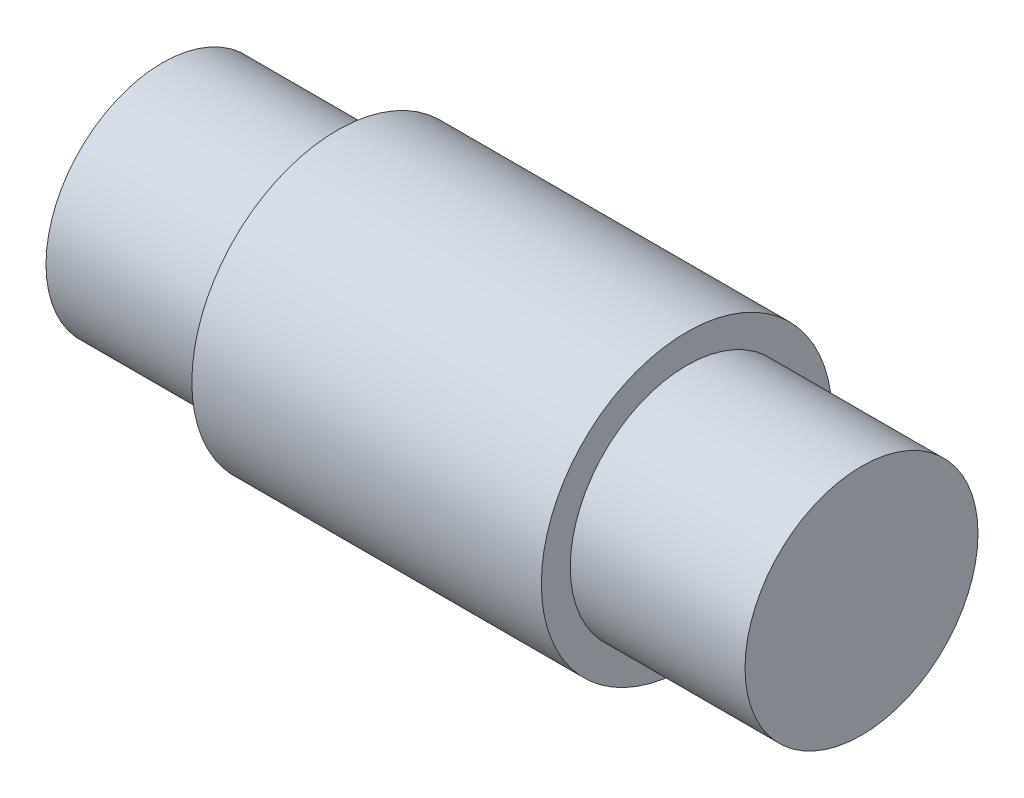
from build123d import *


with BuildPart() as part:
    # Sketch1 → Revolve1 (revolve)
    with BuildSketch(Plane.XY, mode=Mode.PRIVATE) as revolve1_sk:
        Polygon((0, 0), (19.05, 0), (19.05, 3.175), (14.2875, 3.175), (14.2875, 3.9624), (4.7625, 3.9624), (4.7625, 3.175), (0, 3.175), align=None)
    revolve(revolve1_sk.sketch.rotate(Axis((0, 0, 0), (1, 0, 0)), 90), axis=Axis((0, 0, 0), (1, 0, 0)))


solid = part.part
